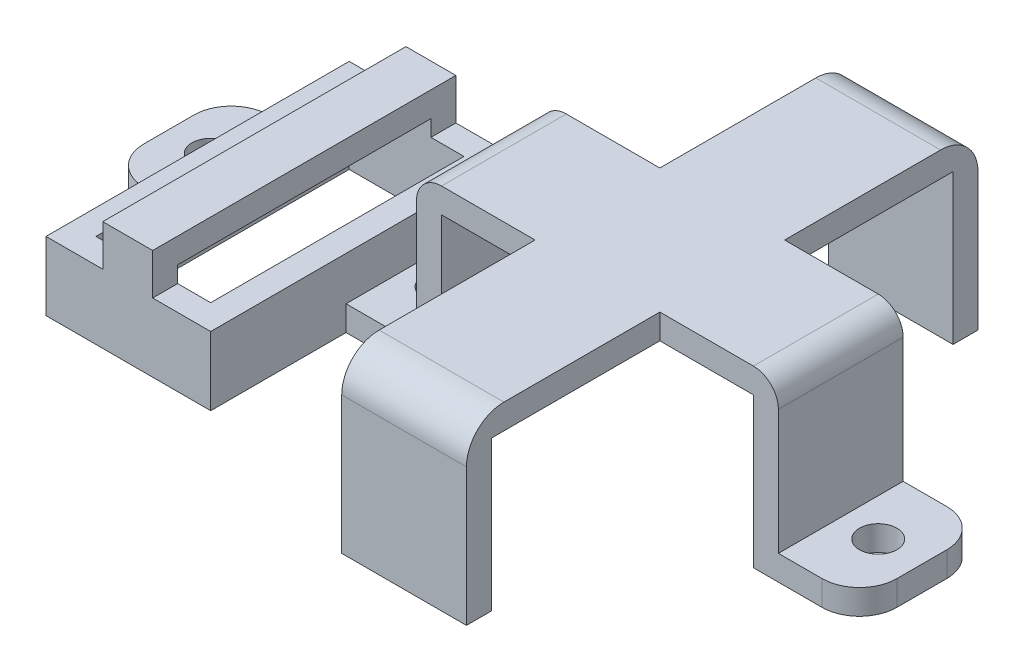
from build123d import *

# Parameters (mm, degrees)
EXTRUIR_L_MINA1_DEPTH             = 10
REDONDEO3_R                       = 2
EXTRUIR_L_MINA2_DEPTH             = 5
REDONDEO4_R                       = 3
CROQUIS2_R                        = 1.5
CORTAR_EXTRUIR1_DEPTH             = 10
CROQUIS5_W                        = 13.2
CROQUIS5_H                        = 24.3
CROQUIS5_W_2                      = 9.2
CROQUIS5_H_2                      = 20.3
EXTRUIR_L_MINA3_DEPTH             = 3.5
EXTRUIR_L_MINA3_DIRECTION_2_REACH = 51.752
CROQUIS7_W                        = 10
CROQUIS7_H                        = 2
SALIENTE_EXTRUIR1_DEPTH           = 6
CORTAR_EXTRUIR2_DEPTH             = 50.751884386
CORTAR_EXTRUIR2_DEPTH_BACK        = 50.751884386
CROQUIS8_R                        = 1.5
EXTRUIR_L_MINA4_DEPTH             = 2
REDONDEO5_R                       = 3


with BuildPart() as part:
    # Croquis1 → Extruir-Lámina1 (new body)
    with BuildSketch(Plane.XY):
        Polygon((-2.15, 0), (0, 0), (7.5, 0), (7.5, 12), (32.5, 12), (32.5, 0), (40, 0), (41, 0), (41, 2), (40, 2), (34.5, 2), (34.5, 14), (5.5, 14), (5.5, 2), (0, 2), (-2.15, 2), align=None)
    extrude(amount=-EXTRUIR_L_MINA1_DEPTH)

    # Redondeo3
    redondeo3_edges = [part.edges().sort_by_distance(p)[0] for p in [
        (5.5, 14, -5),
        (34.5, 14, -5),
    ]]
    fillet(redondeo3_edges, radius=REDONDEO3_R)

    # Croquis3 → Extruir-Lámina2 (add, symmetric)
    with BuildSketch(Plane(origin=(20, 0, 0), x_dir=(0, 0, -1), z_dir=(1, 0, 0))):
        Polygon((23.5, 0), (23.5, 12), (-13.5, 12), (-13.5, 0), (-15.5, 0), (-15.5, 14), (25.5, 14), (25.5, 0), align=None)
    extrude(amount=EXTRUIR_L_MINA2_DEPTH, both=True)

    # Redondeo4
    redondeo4_edges = [part.edges().sort_by_distance(p)[0] for p in [
        (20, 14, -25.5),
        (20, 14, 15.5),
    ]]
    fillet(redondeo4_edges, radius=REDONDEO4_R)

    # Croquis2 → Cortar-Extruir1 (cut)
    with BuildSketch(Plane(origin=(0, 2, 0), x_dir=(1, 0, 0), z_dir=(0, 1, 0))):
        with Locations(Location((2.5, 5, 0), (0, 0, 270))):
            Circle(CROQUIS2_R)
        with Locations(Location((37.5, 5, 0), (0, 0, 270))):
            Circle(CROQUIS2_R)
    extrude(amount=-CORTAR_EXTRUIR1_DEPTH, mode=Mode.SUBTRACT)

    # Croquis5 → Extruir-Lámina3 (add)
    with BuildSketch(Plane(origin=(0, 2, 0), x_dir=(1, 0, 0), z_dir=(0, 1, 0))):
        with Locations((-6.75, 1.3)):
            Rectangle(CROQUIS5_W, CROQUIS5_H)
        with Locations((-6.75, 1.3)):
            Rectangle(CROQUIS5_W_2, CROQUIS5_H_2, mode=Mode.SUBTRACT)
    extrude(amount=EXTRUIR_L_MINA3_DEPTH)

    # Extruir-Lámina3 direction 2: up to this face of the body (flat: up to its plane)
    extruir_l_mina3_direction_2_end = Plane(part.part.faces().sort_by_distance((-2.011031478, 0, -5))[0])
    # Croquis5 → Extruir-Lámina3 direction 2 (add, up to the picked face)
    with BuildSketch(Plane(origin=(0, 2, 0), x_dir=(1, 0, 0), z_dir=(0, 1, 0)), mode=Mode.PRIVATE) as extruir_l_mina3_direction_2_sk1:
        with Locations((-6.75, 1.3)):
            Rectangle(CROQUIS5_W, CROQUIS5_H)
        with Locations((-6.75, 1.3)):
            Rectangle(CROQUIS5_W_2, CROQUIS5_H_2, mode=Mode.SUBTRACT)
    extruir_l_mina3_direction_2_tool1 = split(extrude(extruir_l_mina3_direction_2_sk1.sketch, amount=-EXTRUIR_L_MINA3_DIRECTION_2_REACH, mode=Mode.PRIVATE), bisect_by=extruir_l_mina3_direction_2_end, keep=Keep.BOTH, mode=Mode.PRIVATE)
    add(extruir_l_mina3_direction_2_tool1.solids().sort_by(Axis((-6.75, 2, 10.573462), (0, -1, 0)))[0])

    # Croquis7 → Saliente-Extruir1 (add)
    with BuildSketch(Plane.ZY.offset(13.35)):
        with Locations((-5, 1)):
            Rectangle(CROQUIS7_W, CROQUIS7_H)
    extrude(amount=SALIENTE_EXTRUIR1_DEPTH)

    # Croquis8 → Cortar-Extruir2 (cut, two sides: drawn at the far end of the back side and taken through both)
    with BuildSketch(Plane(origin=(0, 2, 0), x_dir=(1, 0, 0), z_dir=(0, 1, 0)).offset(-CORTAR_EXTRUIR2_DEPTH_BACK)):
        with Locations(Location((-16, 5, 0), (0, 0, 180))):
            Circle(CROQUIS8_R)
    extrude(amount=CORTAR_EXTRUIR2_DEPTH + CORTAR_EXTRUIR2_DEPTH_BACK, mode=Mode.SUBTRACT)

    # Croquis9 → Extruir-Lámina4 (add, symmetric)
    with BuildSketch(Plane.ZY.offset(6.8)):
        Polygon((8.85, 5.5), (8.85, 6.8), (-11.45, 6.8), (-11.45, 5.5), (-13.45, 5.5), (-13.45, 8.8), (10.85, 8.8), (10.85, 5.5), align=None)
    extrude(amount=EXTRUIR_L_MINA4_DEPTH, both=True)

    # Redondeo5
    redondeo5_edges = [part.edges().sort_by_distance(p)[0] for p in [
        (-19.35, 1, -10),
        (-19.35, 1, 0),
        (41, 1, 0),
        (41, 1, -10),
    ]]
    fillet(redondeo5_edges, radius=REDONDEO5_R)


solid = part.part
